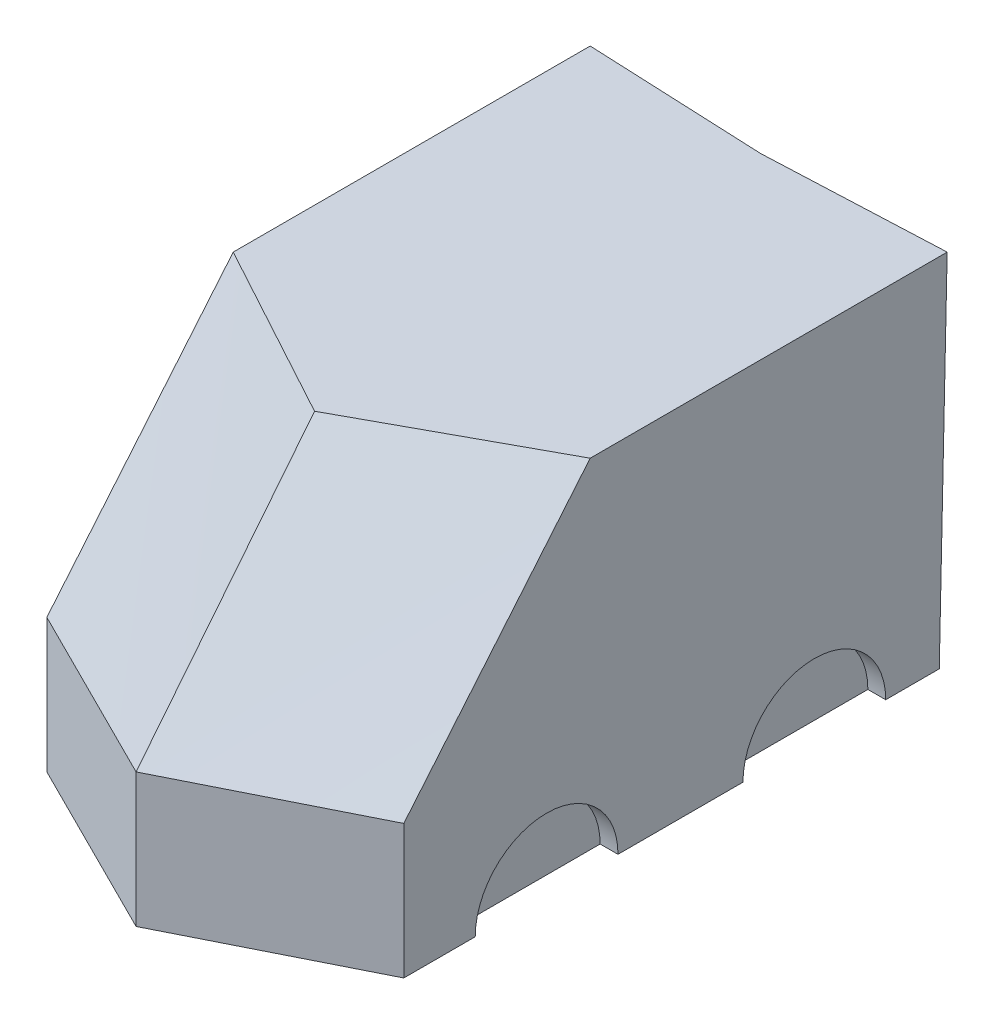
from build123d import *

# Parameters (mm, degrees)
SKETCH3_R          = 40
CUT_EXTRUDE1_DEPTH = 10


with BuildPart() as part:
    # Sketch1 → Loft1 section 0
    with BuildSketch(Plane(origin=(0, 0, 0), x_dir=(0, 0, -1), z_dir=(1, 0, 0))):
        with BuildLine():
            Line((0, 0), (-350, 0))
            Line((-350, 0), (-350, 75))
            Line((-350, 75), (-250, 200))
            Line((-250, 200), (0, 200))
            Line((0, 200), (0, 0))
        make_face()
    # Sketch2 → Loft1 section 1
    with BuildSketch(Plane(origin=(100, 0, 0), x_dir=(0, 0, -1), z_dir=(1, 0, 0))):
        with BuildLine():
            Line((0, 0), (4.422435972, 200))
            Line((4.422435972, 200), (-195.577564028, 200))
            Line((-195.577564028, 200), (-300, 75))
            Line((-300, 75), (-300, 0))
            Line((-300, 0), (0, 0))
        make_face()
    loft1 = loft()

    # Sketch3 → Cut-Extrude1 (cut)
    with BuildSketch(Plane(origin=(100, 0, 0), x_dir=(0, 0, -1), z_dir=(1, 0, 0))):
        with Locations((-220, 0)):
            Circle(SKETCH3_R)
        with Locations((-70, 0)):
            Circle(SKETCH3_R)
    cut_extrude1 = extrude(amount=-CUT_EXTRUDE1_DEPTH, mode=Mode.SUBTRACT)

    # Mirror2: Loft1, Cut-Extrude1 across plane
    add(loft1.mirror(Plane.ZY))
    add(cut_extrude1.mirror(Plane.ZY), mode=Mode.SUBTRACT)


solid = part.part
